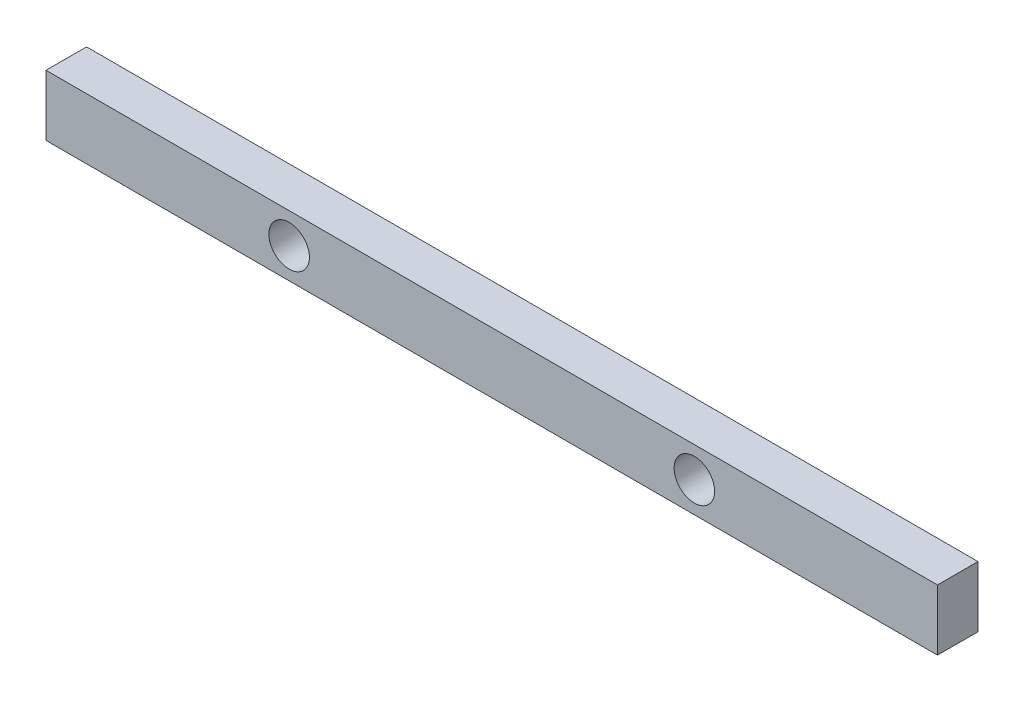
from build123d import *

# Parameters (mm, degrees)
SKETCH_1_W      = 44
SKETCH_1_H      = 3
SKETCH_1_R      = 1
EXTRUDE_1_DEPTH = 2


with BuildPart() as part:
    # 草图1 → 凸台-拉伸1 (new body)
    with BuildSketch(Plane.XY):
        Rectangle(SKETCH_1_W, SKETCH_1_H)
        with Locations((-10, 0)):
            Circle(SKETCH_1_R, mode=Mode.SUBTRACT)
        with Locations((10, 0)):
            Circle(SKETCH_1_R, mode=Mode.SUBTRACT)
    extrude(amount=EXTRUDE_1_DEPTH)


solid = part.part
